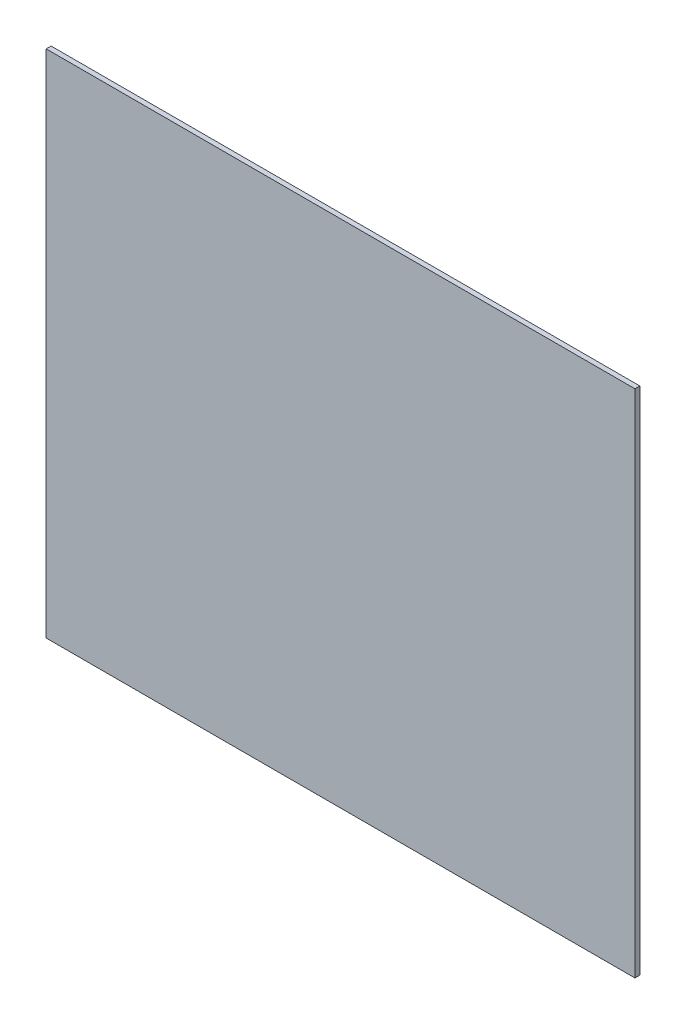
from build123d import *

# Parameters (mm, degrees)
SKETCH1_W           = 190.5
SKETCH1_H           = 165.1
BOSS_EXTRUDE1_DEPTH = 1.5875


with BuildPart() as part:
    # Sketch1 → Boss-Extrude1 (new body)
    with BuildSketch(Plane.XY):
        Rectangle(SKETCH1_W, SKETCH1_H)
    extrude(amount=BOSS_EXTRUDE1_DEPTH)


solid = part.part
